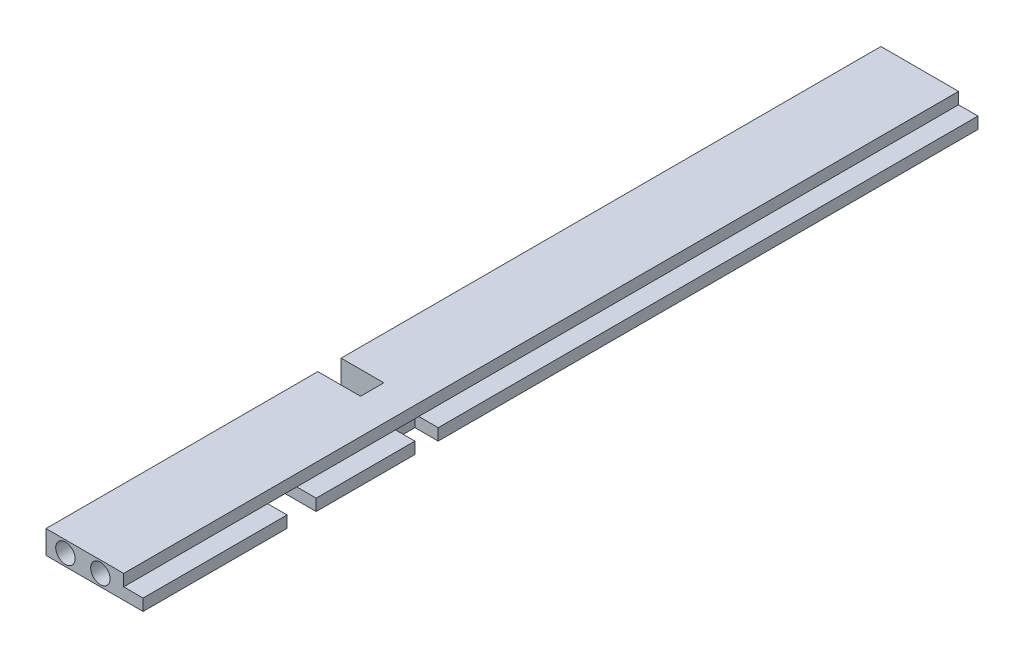
from build123d import *

# Parameters (mm, degrees)
BOSS_EXTRU_1_DEPTH         = 215
ESQUISSE3_W                = 8
ESQUISSE3_H                = 7.5
ESQUISSE3_W_2              = 11
ENL_V_MAT_EXTRU_1_DEPTH    = 3
ESQUISSE4_W                = 11
ESQUISSE4_H                = 6
ENL_V_MAT_EXTRU_2_DEPTH    = 217.531752868
ESQUISSE5_W                = 6
ESQUISSE5_H                = 6
ENL_V_MAT_EXTRU_3_DEPTH    = 3
ESQUISSE8_R                = 2.5
ENL_V_MAT_EXTRU_4_DEPTH    = 10
R_P_TITION_LIN_AIRE1_COUNT = 2
R_P_TITION_LIN_AIRE1_PITCH = 9


with BuildPart() as part:
    # Esquisse1 → Boss.-Extru.1 (new body)
    with BuildSketch(Plane.XY):
        Polygon((0, 0), (0, 6), (20, 6), (20, 3), (25, 3), (25, 0), align=None)
    extrude(amount=BOSS_EXTRU_1_DEPTH)

    # Esquisse3 → Enlèv. mat.-Extru.1 (cut)
    with BuildSketch(Plane.XZ):
        with Locations((21, 174.174574215)):
            Rectangle(ESQUISSE3_W, ESQUISSE3_H)
        with Locations((5.5, 174.174574215)):
            Rectangle(ESQUISSE3_W_2, ESQUISSE3_H)
    extrude(amount=-ENL_V_MAT_EXTRU_1_DEPTH, mode=Mode.SUBTRACT)

    # Esquisse4 → Enlèv. mat.-Extru.2 (cut, through all)
    with BuildSketch(Plane.XZ):
        with Locations((5.5, 142)):
            Rectangle(ESQUISSE4_W, ESQUISSE4_H)
    extrude(amount=-ENL_V_MAT_EXTRU_2_DEPTH, mode=Mode.SUBTRACT)

    # Esquisse5 → Enlèv. mat.-Extru.3 (cut)
    with BuildSketch(Plane.XZ):
        with Locations((22, 142)):
            Rectangle(ESQUISSE5_W, ESQUISSE5_H)
    extrude(amount=-ENL_V_MAT_EXTRU_3_DEPTH, mode=Mode.SUBTRACT)

    # Esquisse8 → Enlèv. mat.-Extru.4 (cut)
    with BuildSketch(Plane.XY.offset(215)):
        with Locations((5, 3)):
            Circle(ESQUISSE8_R)
    enl_v_mat_extru_4 = extrude(amount=-ENL_V_MAT_EXTRU_4_DEPTH, mode=Mode.SUBTRACT)

    # Répétition linéaire1: Enlèv. mat.-Extru.4 ×2
    with Locations(*[(i * R_P_TITION_LIN_AIRE1_PITCH, 0, 0) for i in range(1, R_P_TITION_LIN_AIRE1_COUNT)]):
        add(enl_v_mat_extru_4, mode=Mode.SUBTRACT)


solid = part.part
